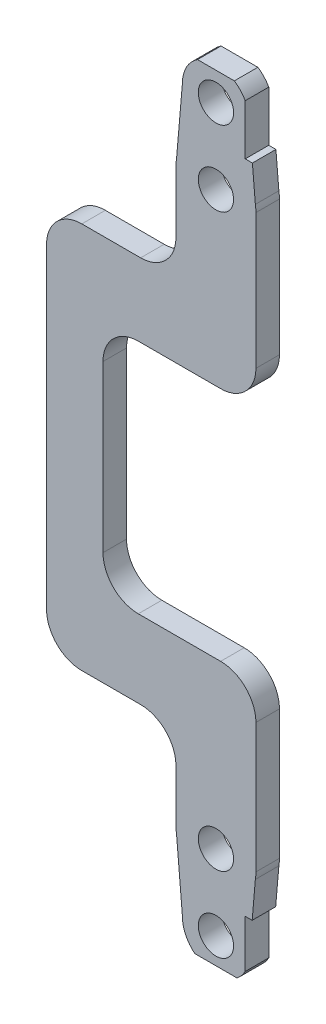
from build123d import *

# Parameters (mm, degrees)
SKIZZE5_R                       = 2.85
AUFSATZ_LINEAR_AUSTRAGEN2_DEPTH = 2
SKIZZE7_R                       = 1.5
SKIZZE7_R_2                     = 2.5
SCHNITT_LINEAR_AUSTRAGEN1_DEPTH = 2
SKIZZE8_W                       = 11
SKIZZE8_H                       = 32.890928956
AUFSATZ_LINEAR_AUSTRAGEN3_DEPTH = 2
SKIZZE9_W                       = 13
SKIZZE9_H                       = 20.072612556
SCHNITT_LINEAR_AUSTRAGEN2_DEPTH = 2
SKIZZE10_R                      = 3.4
AUFSATZ_LINEAR_AUSTRAGEN4_DEPTH = 2
SKIZZE11_R                      = 1.5
SCHNITT_LINEAR_AUSTRAGEN3_DEPTH = 5
VERRUNDUNG3_R                   = 3
VERRUNDUNG4_R                   = 3
VERRUNDUNG5_R                   = 3
VERRUNDUNG6_R                   = 3
SKIZZE12_W                      = 4.557802571
SKIZZE12_H                      = 1.72453781
SKIZZE12_W_2                    = 7.81907696
SKIZZE12_H_2                    = 1.295060399
SKIZZE12_W_3                    = 1.755726722
SKIZZE12_H_3                    = 5.084854061
SKIZZE12_H_4                    = 4.524687863
SCHNITT_LINEAR_AUSTRAGEN4_DEPTH = 10


with BuildPart() as part:
    # Skizze5 → Aufsatz-Linear austragen2 (new body)
    with BuildSketch(Plane.XY):
        with BuildLine():
            Line((-40.726132402, -24.649552882), (-40.726132402, 23.890447118))
            ThreePointArc((-40.726132402, 23.890447118), (-44.126132402, 20.490447118), (-47.526132402, 23.890447118))
            Line((-47.526132402, 23.890447118), (-47.526132402, -24.649552882))
            ThreePointArc((-47.526132402, -24.649552882), (-44.126132402, -21.249552882), (-40.726132402, -24.649552882))
        make_face()
        with BuildLine():
            Line((-40.726132402, 23.890447118), (-40.775983963, 24.470537999))
            ThreePointArc((-40.775983963, 24.470537999), (-44.126132402, 27.290447118), (-47.476280842, 24.470537999))
            Line((-47.476280842, 24.470537999), (-47.526132402, 23.890447118))
            ThreePointArc((-47.526132402, 23.890447118), (-44.126132402, 20.490447118), (-40.726132402, 23.890447118))
        make_face()
        with Locations((-44.126132402, 30.290447118)):
            Circle(SKIZZE5_R)
        with BuildLine():
            Line((-40.775983963, 24.470537999), (-41.276132402, 30.290447118))
            ThreePointArc((-41.276132402, 30.290447118), (-44.126132402, 27.440447118), (-46.976132402, 30.290447118))
            Line((-46.976132402, 30.290447118), (-47.476280842, 24.470537999))
            ThreePointArc((-47.476280842, 24.470537999), (-44.126132402, 27.290447118), (-40.775983963, 24.470537999))
        make_face()
        with BuildLine():
            Line((-40.775983963, -25.229643764), (-40.726132402, -24.649552882))
            ThreePointArc((-40.726132402, -24.649552882), (-44.126132402, -21.249552882), (-47.526132402, -24.649552882))
            Line((-47.526132402, -24.649552882), (-47.476280842, -25.229643764))
            ThreePointArc((-47.476280842, -25.229643764), (-44.126132402, -28.049552882), (-40.775983963, -25.229643764))
        make_face()
        with BuildLine():
            Line((-41.276132402, -31.049552882), (-40.775983963, -25.229643764))
            ThreePointArc((-40.775983963, -25.229643764), (-44.126132402, -28.049552882), (-47.476280842, -25.229643764))
            Line((-47.476280842, -25.229643764), (-46.976132402, -31.049552882))
            ThreePointArc((-46.976132402, -31.049552882), (-44.126132402, -28.199552882), (-41.276132402, -31.049552882))
        make_face()
        with Locations((-44.126132402, -31.049552882)):
            Circle(SKIZZE5_R)
    extrude(amount=AUFSATZ_LINEAR_AUSTRAGEN2_DEPTH)

    # Skizze7 → Schnitt-Linear austragen1 (cut)
    with BuildSketch(Plane(origin=(0, 0, 0), x_dir=(-1, 0, 0), z_dir=(0, 0, -1))):
        with Locations((44.126132402, 30.290447118)):
            Circle(SKIZZE7_R)
        with Locations((44.126132402, 23.890447118)):
            Circle(SKIZZE7_R_2)
        with Locations((44.126132402, -24.649552882)):
            Circle(SKIZZE7_R_2)
        with Locations((44.126132402, -31.049552882)):
            Circle(SKIZZE7_R)
    extrude(amount=-SCHNITT_LINEAR_AUSTRAGEN1_DEPTH, mode=Mode.SUBTRACT)

    # Skizze8 → Aufsatz-Linear austragen3 (add)
    with BuildSketch(Plane(origin=(0, 0, 0), x_dir=(-1, 0, 0), z_dir=(0, 0, -1))):
        with Locations((53.026132402, -0.786592511)):
            Rectangle(SKIZZE8_W, SKIZZE8_H)
    extrude(amount=-AUFSATZ_LINEAR_AUSTRAGEN3_DEPTH)

    # Skizze9 → Schnitt-Linear austragen2 (cut)
    with BuildSketch(Plane(origin=(0, 0, 0), x_dir=(-1, 0, 0), z_dir=(0, 0, -1))):
        with Locations((47.226132402, -0.610696343)):
            Rectangle(SKIZZE9_W, SKIZZE9_H)
    extrude(amount=-SCHNITT_LINEAR_AUSTRAGEN2_DEPTH, mode=Mode.SUBTRACT)

    # Skizze10 → Aufsatz-Linear austragen4 (add)
    with BuildSketch(Plane(origin=(0, 0, 0), x_dir=(-1, 0, 0), z_dir=(0, 0, -1))):
        with Locations((44.126132402, 23.890447118)):
            Circle(SKIZZE10_R)
        with Locations((44.126132402, -24.649552882)):
            Circle(SKIZZE10_R)
    extrude(amount=-AUFSATZ_LINEAR_AUSTRAGEN4_DEPTH)

    # Skizze11 → Schnitt-Linear austragen3 (cut)
    with BuildSketch(Plane(origin=(0, 0, 0), x_dir=(-1, 0, 0), z_dir=(0, 0, -1))):
        with Locations((44.126132402, -24.649552882)):
            Circle(SKIZZE11_R)
        with Locations((44.126132402, 23.890447118)):
            Circle(SKIZZE11_R)
    extrude(amount=-SCHNITT_LINEAR_AUSTRAGEN3_DEPTH, mode=Mode.SUBTRACT)

    # Verrundung3
    verrundung3_edges = [part.edges().sort_by_distance(p)[0] for p in [
        (-40.726132402, 9.425609935, 1),
        (-53.726132402, 9.425609935, 1),
    ]]
    fillet(verrundung3_edges, radius=VERRUNDUNG3_R)

    # Verrundung4
    verrundung4_edges = [part.edges().sort_by_distance(p)[0] for p in [
        (-40.726132402, -10.647002621, 1),
        (-53.726132402, -10.647002621, 1),
    ]]
    fillet(verrundung4_edges, radius=VERRUNDUNG4_R)

    # Verrundung5
    verrundung5_edges = [part.edges().sort_by_distance(p)[0] for p in [
        (-47.526132402, -17.232056989, 1),
        (-58.526132402, -17.232056989, 1),
    ]]
    fillet(verrundung5_edges, radius=VERRUNDUNG5_R)

    # Verrundung6
    verrundung6_edges = [part.edges().sort_by_distance(p)[0] for p in [
        (-47.526132402, 15.658871967, 1),
        (-58.526132402, 15.658871967, 1),
    ]]
    fillet(verrundung6_edges, radius=VERRUNDUNG6_R)

    # Skizze12 → Schnitt-Linear austragen4 (cut)
    with BuildSketch(Plane(origin=(0, 0, 0), x_dir=(-1, 0, 0), z_dir=(0, 0, -1))):
        with Locations((44.015184194, 33.533655536)):
            Rectangle(SKIZZE12_W, SKIZZE12_H)
        with Locations((44.191445116, -33.911577792)):
            Rectangle(SKIZZE12_W_2, SKIZZE12_H_2)
        with Locations((40.756736433, 29.933182837)):
            Rectangle(SKIZZE12_W_3, SKIZZE12_H_3)
        with Locations((40.756736433, -30.635891291)):
            Rectangle(SKIZZE12_W_3, SKIZZE12_H_4)
    extrude(amount=-SCHNITT_LINEAR_AUSTRAGEN4_DEPTH, mode=Mode.SUBTRACT)


solid = part.part
